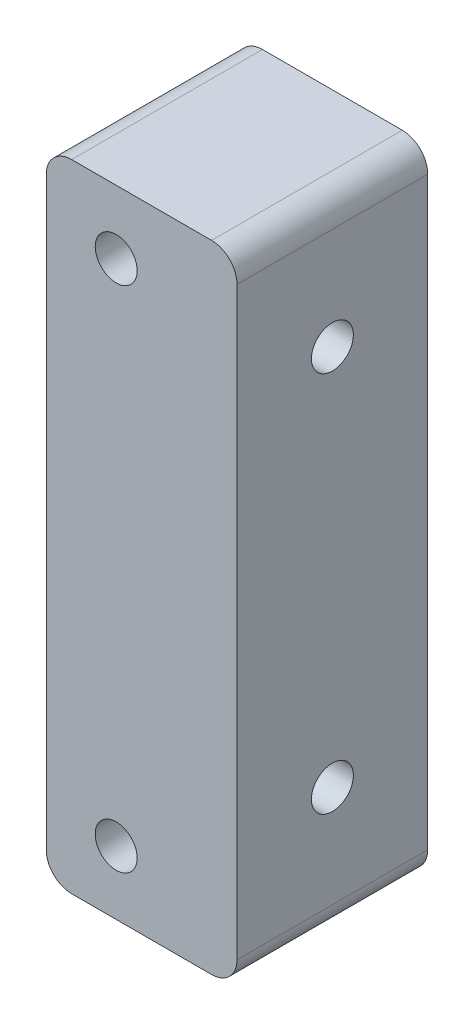
from build123d import *

# Parameters (mm, degrees)
SKETCH_1_W          = 15
SKETCH_1_H          = 50
SKETCH_1_R          = 1.65
EXTRUDE_1_DEPTH     = 15
SKETCH_2_R          = 1.65
CUT_EXTRUDE_1_DEPTH = 15
FILLET_1_R          = 2


with BuildPart() as part:
    # ｽｹｯﾁ1 → ﾎﾞｽ - 押し出し1 (new body)
    with BuildSketch(Plane.XY):
        with Locations((7.5, 25)):
            Rectangle(SKETCH_1_W, SKETCH_1_H)
        with Locations((5.5, 5)):
            Circle(SKETCH_1_R, mode=Mode.SUBTRACT)
        with Locations(Location((5.5, 45, 0), (0, 0, 180))):
            Circle(SKETCH_1_R, mode=Mode.SUBTRACT)
    extrude(amount=EXTRUDE_1_DEPTH)

    # ｽｹｯﾁ2 → ｶｯﾄ - 押し出し1 (cut)
    with BuildSketch(Plane.ZY):
        with Locations((7.5, 40)):
            Circle(SKETCH_2_R)
        with Locations((7.5, 10)):
            Circle(SKETCH_2_R)
    extrude(amount=-CUT_EXTRUDE_1_DEPTH, mode=Mode.SUBTRACT)

    # ﾌｨﾚｯﾄ1
    fillet_1_edges = [part.edges().sort_by_distance(p)[0] for p in [
        (0, 50, 7.5),
        (15, 50, 7.5),
        (15, 0, 7.5),
        (0, 0, 7.5),
    ]]
    fillet(fillet_1_edges, radius=FILLET_1_R)


solid = part.part
